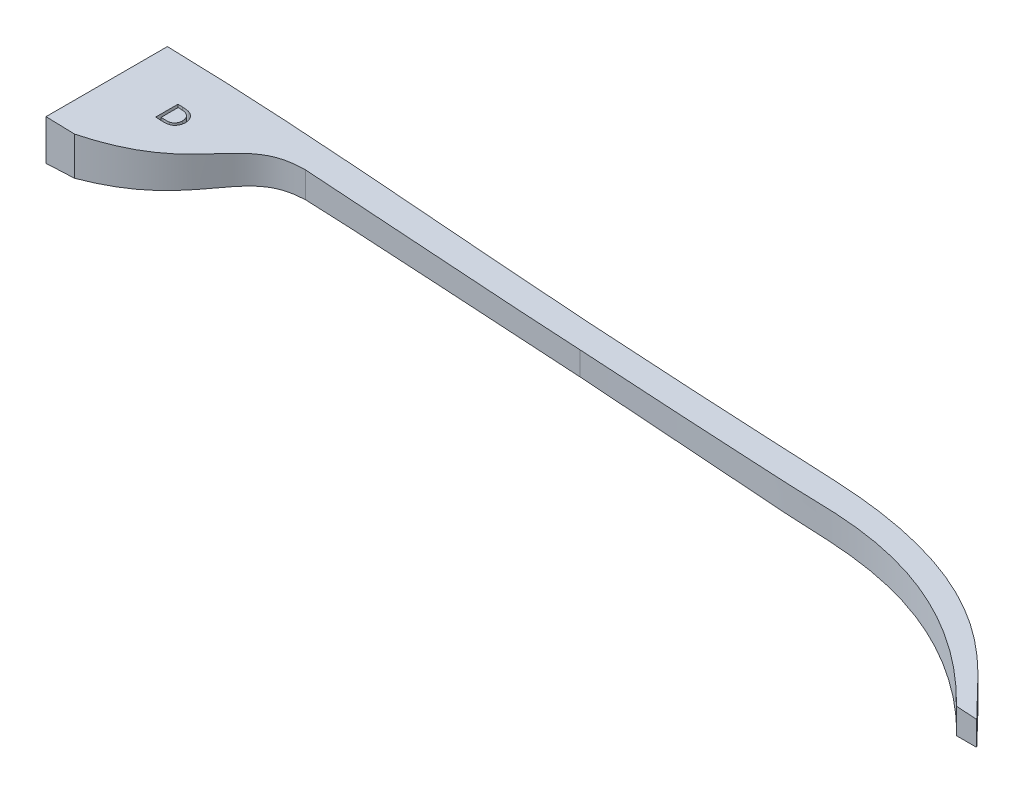
from build123d import *

# Parameters (mm, degrees)
SKETCH1_W           = 146.05
SKETCH1_H           = 19.05
BOSS_EXTRUDE1_DEPTH = 12.7
CUT_EXTRUDE5_DEPTH  = 1.905
CUT_EXTRUDE2_DEPTH  = 19.05
CUT_EXTRUDE3_DEPTH  = 148.833673551
SKETCH5_W           = 6.985
SKETCH5_H           = 3.81
CUT_EXTRUDE4_DEPTH  = 6.35


with BuildPart() as part:
    # Sketch1 → Boss-Extrude1 (new body)
    with BuildSketch(Plane(origin=(0, 0, 0), x_dir=(1, 0, 0), z_dir=(0, 1, 0))):
        with Locations((73.025, 9.525)):
            Rectangle(SKETCH1_W, SKETCH1_H)
    extrude(amount=BOSS_EXTRUDE1_DEPTH)

    # Sketch6 → Cut-Extrude5 (cut)
    with BuildSketch(Plane(origin=(0, 12.7, 0), x_dir=(1, 0, 0), z_dir=(0, 1, 0))):
        with BuildLine():
            Line((8.386565544, 8.821729229), (8.386565544, 12.321729229))
            Line((8.386565544, 12.321729229), (9.127651281, 12.321729229))
            add(Edge.make_bspline(
                [(9.127651281, 12.321729229), (9.190055456, 12.321294255), (9.310215963, 12.320456706), (9.483925956, 12.314964082), (9.644125839, 12.305519416), (9.791158887, 12.291283327), (9.924877382, 12.274540435), (10.045238835, 12.252389885), (10.152703263, 12.228511702), (10.218507592, 12.20655268), (10.249446153, 12.196228427)],
                knots=[0, 0, 0, 0, 1.321377177, 2.544338591, 3.679698859, 4.71869479, 5.671952218, 6.531967125, 7.309789724, 8, 8, 8, 8], degree=3))
            add(Edge.make_bspline(
                [(10.249446153, 12.196228427), (10.292763534, 12.179905899), (10.378260767, 12.147689478), (10.499398787, 12.087215103), (10.61384503, 12.020868259), (10.720173536, 11.945556658), (10.818181258, 11.861754727), (10.909550167, 11.771292819), (10.991461064, 11.671533455), (11.066491879, 11.565292075), (11.132972302, 11.452445814), (11.19051687, 11.334476921), (11.239118147, 11.211611915), (11.279088693, 11.084163559), (11.309721615, 10.951902427), (11.332357721, 10.815188346), (11.345883327, 10.673667558), (11.347357568, 10.577601157), (11.348104005, 10.528960799)],
                knots=[0, 0, 0, 0, 1.037989101, 2.048720264, 3.03347809, 4.003905725, 4.967380877, 5.923996735, 6.884742632, 7.859453364, 8.839691521, 9.819957728, 10.801471334, 11.80152298, 12.813966534, 13.844978706, 14.908869198, 16, 16, 16, 16], degree=3))
            add(Edge.make_bspline(
                [(11.348104005, 10.528960799), (11.347451889, 10.486870536), (11.34616369, 10.403724972), (11.335266868, 10.280583468), (11.318021623, 10.160897976), (11.293371343, 10.044745226), (11.261852951, 9.932289641), (11.223022463, 9.823215406), (11.177755166, 9.717383483), (11.124980677, 9.615999391), (11.067131625, 9.519367843), (11.003886056, 9.428880622), (10.936504069, 9.344507306), (10.864830687, 9.266239474), (10.788199374, 9.194491761), (10.706710618, 9.129319046), (10.620846137, 9.070054344), (10.52977567, 9.017106551), (10.431797364, 8.970031677), (10.325105207, 8.930520488), (10.209488198, 8.897099426), (10.085062006, 8.868683848), (9.951172999, 8.84845454), (9.808484084, 8.833144203), (9.656914603, 8.822838948), (9.552782407, 8.822106035), (9.499245832, 8.821729229)],
                knots=[0, 0, 0, 0, 1.058131973, 2.090245403, 3.105765157, 4.096918797, 5.07359586, 6.040054961, 7.006085223, 7.965371986, 8.911666288, 9.835956746, 10.738988486, 11.624821356, 12.502036588, 13.375701924, 14.24610047, 15.122941669, 16.021834204, 16.975760622, 17.979893693, 19.046217526, 20.182340398, 21.382202726, 22.654134781, 24, 24, 24, 24], degree=3))
            Line((9.499245832, 8.821729229), (8.386565544, 8.821729229))
        make_face()
        with BuildLine():
            Line((8.835283493, 9.225575382), (9.139570352, 9.225575382))
            add(Edge.make_bspline(
                [(9.139570352, 9.225575382), (9.195664504, 9.22579143), (9.303429261, 9.226206487), (9.458381569, 9.230807302), (9.599882351, 9.236300584), (9.727477678, 9.246499795), (9.841447122, 9.257882439), (9.941793056, 9.272590254), (10.028925728, 9.289129753), (10.081504303, 9.304661265), (10.105716185, 9.311813363)],
                knots=[0, 0, 0, 0, 1.383618687, 2.658126108, 3.823786659, 4.876093986, 5.815132222, 6.648351516, 7.377580062, 8, 8, 8, 8], degree=3))
            add(Edge.make_bspline(
                [(10.105716185, 9.311813363), (10.13581217, 9.322573253), (10.195261417, 9.343827497), (10.280444968, 9.383378285), (10.360727571, 9.42900033), (10.435839983, 9.481104596), (10.506416652, 9.539005985), (10.572513741, 9.602639013), (10.632955911, 9.673312109), (10.688116761, 9.749620191), (10.738098497, 9.831043532), (10.781540652, 9.917315597), (10.818286405, 10.008261712), (10.847295082, 10.103662014), (10.870738927, 10.203395358), (10.887420576, 10.307643308), (10.897265876, 10.416591397), (10.898671273, 10.490612587), (10.899386057, 10.528259677)],
                knots=[0, 0, 0, 0, 0.982760408, 1.941267819, 2.884666843, 3.819923004, 4.749609063, 5.690155114, 6.638335438, 7.60609908, 8.583824457, 9.574050268, 10.573936541, 11.597196452, 12.638231748, 13.723193679, 14.842018967, 16, 16, 16, 16], degree=3))
            add(Edge.make_bspline(
                [(10.899386057, 10.528259677), (10.898822713, 10.567788885), (10.897713654, 10.645610378), (10.885677138, 10.760039185), (10.868854559, 10.870303398), (10.843517443, 10.97607643), (10.810131571, 11.077030202), (10.771390137, 11.174307704), (10.72384978, 11.266409994), (10.670082374, 11.353933284), (10.610012848, 11.435965242), (10.543615386, 11.511253324), (10.472114956, 11.58059838), (10.393779364, 11.641908951), (10.31083066, 11.698106636), (10.221563539, 11.746033702), (10.126952119, 11.788111823), (10.060819974, 11.809998489), (10.027190544, 11.821128267)],
                knots=[0, 0, 0, 0, 1.129217777, 2.223100788, 3.284889252, 4.31516385, 5.326848226, 6.321524555, 7.304244934, 8.284784113, 9.254596696, 10.205833222, 11.15055266, 12.096616828, 13.045035565, 14.010353181, 14.988227444, 16, 16, 16, 16], degree=3))
            add(Edge.make_bspline(
                [(10.027190544, 11.821128267), (9.998761159, 11.828948584), (9.938371411, 11.845560514), (9.839940862, 11.864741382), (9.729024235, 11.881183706), (9.605108596, 11.895275745), (9.468757432, 11.905559155), (9.319335448, 11.912002343), (9.157370537, 11.917415206), (9.044924198, 11.917723508), (8.9867258, 11.917883075)],
                knots=[0, 0, 0, 0, 0.675026783, 1.433893058, 2.294494921, 3.24250292, 4.28921909, 5.425097092, 6.667317884, 8, 8, 8, 8], degree=3))
            Line((8.9867258, 11.917883075), (8.835283493, 11.917883075))
            Line((8.835283493, 11.917883075), (8.835283493, 9.225575382))
        make_face(mode=Mode.SUBTRACT)
    extrude(amount=-CUT_EXTRUDE5_DEPTH, mode=Mode.SUBTRACT)

    # Sketch4 → Cut-Extrude2 (cut)
    with BuildSketch(Plane(origin=(0, 12.7, 0), x_dir=(1, 0, 0), z_dir=(0, 1, 0))):
        with BuildLine():
            add(Edge.make_bspline(
                [(4.476723392, 0), (17.725756487, 4.043101895), (17.090749047, 12.999753789), (25.262791442, 14.373397692), (26.219517358, 14.465775476)],
                knots=[0, 0, 0, 0, 0.256127126, 0.284585695, 0.284585695, 0.284585695, 0.284585695], degree=3))
            Line((4.476723392, 0), (142.875, 0))
            add(Edge.make_bspline(
                [(68.923918907, 14.861089556), (81.075041449, 14.855684794), (98.246564786, 14.797098309), (108.068516517, 14.713978549), (127.226778846, 16.049688466), (142.875, 0)],
                knots=[0.488488537, 0.488488537, 0.488488537, 0.488488537, 0.629203286, 0.700744717, 1, 1, 1, 1], degree=3))
            Line((68.923918907, 14.861089556), (26.219517358, 14.465775476))
        make_face()
        with BuildLine():
            add(Edge.make_bspline(
                [(105.157866441, 19.05), (131.491281961, 18.918345897), (139.296835945, 6.588803862), (146.05, 0)],
                knots=[0.010622627, 0.010622627, 0.010622627, 0.010622627, 1, 1, 1, 1], degree=3))
            Line((146.05, 0), (146.05, 19.05))
            Line((146.05, 19.05), (105.157866441, 19.05))
        make_face()
    extrude(amount=-CUT_EXTRUDE2_DEPTH, mode=Mode.SUBTRACT)

    # Sketch3 → Cut-Extrude3 (cut, through all)
    with BuildSketch(Plane(origin=(0, 0, -19.05), x_dir=(-1, 0, 0), z_dir=(0, 0, -1))):
        with BuildLine():
            Line((0, 0), (0, 6.35))
            add(Edge.make_bspline(
                [(0, 6.35), (-24.113300152, 7.43392212), (-15.641275309, 8.196230935), (-74.094859357, 4.018359708), (-116.928263327, 0.799878695), (-134.594160521, 0)],
                knots=[0, 0, 0, 0, 0.484783121, 0.563883674, 0.880019025, 0.880019025, 0.880019025, 0.880019025], degree=3))
            Line((-134.594160521, 0), (0, 0))
        make_face()
        with BuildLine():
            add(Edge.make_bspline(
                [(0, 12.7), (-20.007581879, 12.263313866), (-68.541646062, 7.162612776), (-117.328211009, 5.684686174), (-146.05, 3.81)],
                knots=[0, 0, 0, 0, 0.409813507, 1, 1, 1, 1], degree=3))
            Line((0, 12.7), (-146.05, 12.7))
            Line((-146.05, 12.7), (-146.05, 3.81))
        make_face()
    extrude(amount=-CUT_EXTRUDE3_DEPTH, mode=Mode.SUBTRACT)

    # Sketch5 → Cut-Extrude4 (cut)
    with BuildSketch(Plane.ZY):
        with Locations((-9.2075, 8.255)):
            Rectangle(SKETCH5_W, SKETCH5_H)
    extrude(amount=-CUT_EXTRUDE4_DEPTH, mode=Mode.SUBTRACT)


solid = part.part
